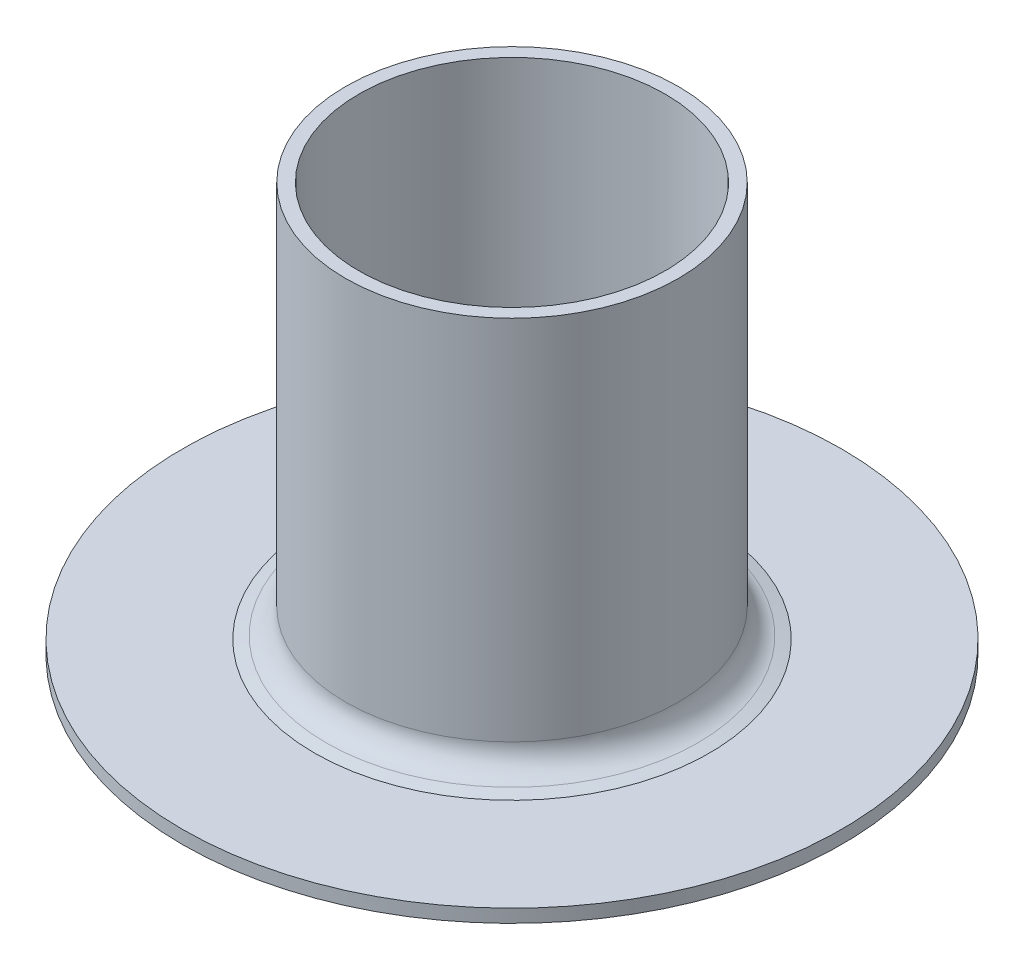
from build123d import *


with BuildPart() as part:
    # Sketch1 → Revolve1 (revolve)
    with BuildSketch(Plane.XY, mode=Mode.PRIVATE) as revolve1_sk:
        with BuildLine():
            Line((38.0492, 0), (35.819999251, 0.59731254))
            ThreePointArc((35.819999251, 0.59731254), (33.104565031, 2.411707679), (32.0548, 5.504215738))
            Line((32.0548, 5.504215738), (32.0548, 76.2))
            Line((32.0548, 76.2), (29.5148, 76.2))
            Line((29.5148, 76.2), (29.5148, -2.54))
            Line((29.5148, -2.54), (63.5, -2.54))
            Line((63.5, -2.54), (63.5, 0))
            Line((63.5, 0), (38.0492, 0))
        make_face()
    revolve(revolve1_sk.sketch.rotate(Axis((0, 0, 0), (0, 1, 0)), 90), axis=Axis((0, 0, 0), (0, 1, 0)))


solid = part.part
